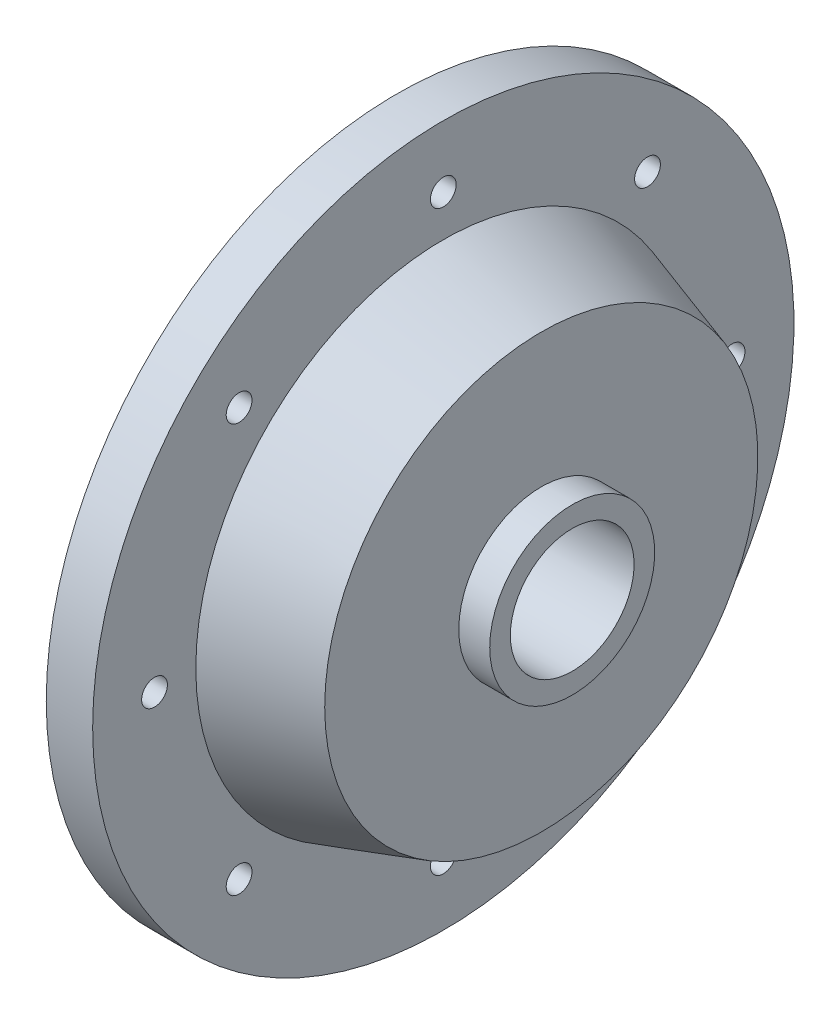
from build123d import *

# Parameters (mm, degrees)
SKETCH2_R          = 2.5
CUT_EXTRUDE1_DEPTH = 100.36297097


with BuildPart() as part:
    # Sketch1 → Revolve1 (revolve)
    with BuildSketch(Plane.XY, mode=Mode.PRIVATE) as revolve1_sk:
        Polygon((5, 12), (34, 12), (34, 16), (28, 16), (28, 42), (9, 48), (9, 68), (0, 68), (0, 64), (5, 64), (5, 40), (20, 40), (20, 16), (5, 16), align=None)
    revolve(revolve1_sk.sketch.rotate(Axis((0, 0, 0), (1, 0, 0)), 90), axis=Axis((0, 0, 0), (1, 0, 0)))

    # Sketch2 → Cut-Extrude1 (cut, through all)
    with BuildSketch(Plane(origin=(9, 0, 0), x_dir=(0, 0, -1), z_dir=(1, 0, 0))):
        with Locations((0, 56)):
            Circle(SKETCH2_R)
        with Locations((39.597979746, 39.597979746)):
            Circle(SKETCH2_R)
        with Locations((56, 0)):
            Circle(SKETCH2_R)
        with Locations((39.597979746, -39.597979746)):
            Circle(SKETCH2_R)
        with Locations((0, -56)):
            Circle(SKETCH2_R)
        with Locations((-39.597979746, -39.597979746)):
            Circle(SKETCH2_R)
        with Locations((-56, 0)):
            Circle(SKETCH2_R)
        with Locations((-39.597979746, 39.597979746)):
            Circle(SKETCH2_R)
    extrude(amount=-CUT_EXTRUDE1_DEPTH, mode=Mode.SUBTRACT)


solid = part.part
